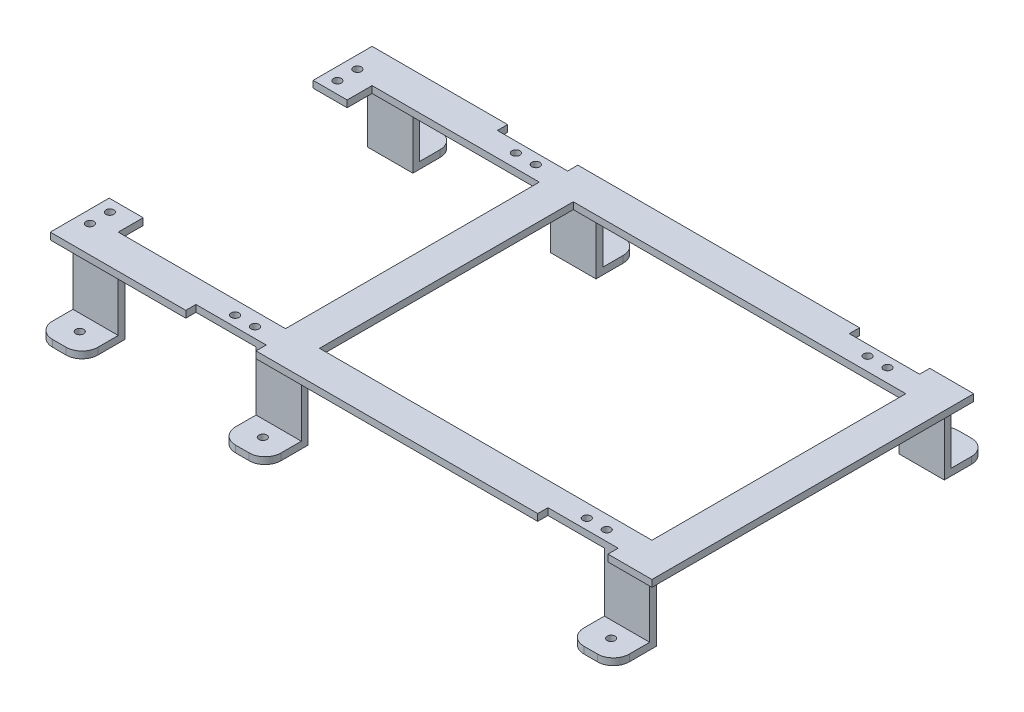
from build123d import *

# Parameters (mm, degrees)
CROQUIS1_W                 = 265.5
CROQUIS1_H                 = 142
CROQUIS1_W_2               = 235.5
CROQUIS1_H_2               = 112
SALIENTE_EXTRUIR1_DEPTH    = 3
SALIENTE_EXTRUIR2_DEPTH    = 20
SIMETR_A2_COPY_1_DEPTH     = 20
SALIENTE_EXTRUIR3_DEPTH    = 10
CROQUIS5_W                 = 38.206392887
CROQUIS5_H                 = 90
CORTAR_EXTRUIR2_DEPTH      = 160.539376017
CROQUIS6_W                 = 15
CROQUIS6_H                 = 112
SALIENTE_EXTRUIR4_DEPTH    = 3
CROQUIS8_W                 = 31
CROQUIS8_H                 = 4.5
CORTAR_EXTRUIR4_DEPTH      = 3
CROQUIS9_R                 = 1.75
CORTAR_EXTRUIR5_DEPTH      = 160.539376017
CROQUIS11_R                = 1.75
CORTAR_EXTRUIR7_DEPTH      = 4
CROQUIS12_R                = 1.75
CORTAR_EXTRUIR8_DEPTH      = 4
REDONDEO1_R                = 7
REDONDEO2_R                = 7
CROQUIS13_R                = 1.75
CORTAR_EXTRUIR9_DEPTH      = 159.964815289
CROQUIS15_R                = 1.75
CORTAR_EXTRUIR10_DEPTH     = 159.964815289
SIMETR_A12_COPY_1_SKETCH_R = 1.75
SIMETR_A12_COPY_1_DEPTH    = 159.964815289
REDONDEO3_R                = 7


with BuildPart() as part:
    # Croquis1 → Saliente-Extruir1 (new body)
    with BuildSketch(Plane(origin=(0, 0, 0), x_dir=(1, 0, 0), z_dir=(0, 1, 0))):
        Rectangle(CROQUIS1_W, CROQUIS1_H)
        Rectangle(CROQUIS1_W_2, CROQUIS1_H_2, mode=Mode.SUBTRACT)
    extrude(amount=SALIENTE_EXTRUIR1_DEPTH)

    # Croquis2 → Saliente-Extruir2 (add)
    with BuildSketch(Plane.ZY.offset(127.25)):
        Polygon((66.5, 0), (66.5, -26), (82.5, -26), (82.5, -29), (63.5, -29), (63.5, 0), align=None)
    saliente_extruir2 = extrude(amount=-SALIENTE_EXTRUIR2_DEPTH)

    # Simetría1: Saliente-Extruir2 across plane
    add(saliente_extruir2.mirror(Plane(origin=(0, 0, 0), x_dir=(0, 0, 1), z_dir=(1, 0, 0))))

    # Simetría2: Saliente-Extruir2 across plane
    add(saliente_extruir2.mirror(Plane.XY))

    # Simetría2 copy 1 sketch → Simetría2 copy 1 (add)
    with BuildSketch(Plane(origin=(127.25, 0, 0), x_dir=(0, 0, -1), z_dir=(1, 0, 0))):
        Polygon((66.5, 0), (66.5, -26), (82.5, -26), (82.5, -29), (63.5, -29), (63.5, 0), align=None)
    extrude(amount=-SIMETR_A2_COPY_1_DEPTH)

    # Croquis4 → Saliente-Extruir3 (add, symmetric)
    with BuildSketch(Plane(origin=(-36.45, 0, 0), x_dir=(0, 0, -1), z_dir=(1, 0, 0))):
        Polygon((-82.5, -29), (-63.5, -29), (-63.5, 0), (-66.5, 0), (-66.5, -26), (-82.5, -26), align=None)
    saliente_extruir3 = extrude(amount=SALIENTE_EXTRUIR3_DEPTH, both=True)

    # Simetría4: Saliente-Extruir3 across plane
    add(saliente_extruir3.mirror(Plane.XY))

    # Croquis5 → Cortar-Extruir2 (cut, through all)
    with BuildSketch(Plane(origin=(0, 3, 0), x_dir=(1, 0, 0), z_dir=(0, 1, 0))):
        with Locations((-124.602228384, 0)):
            Rectangle(CROQUIS5_W, CROQUIS5_H)
    extrude(amount=-CORTAR_EXTRUIR2_DEPTH, mode=Mode.SUBTRACT)

    # Croquis6 → Saliente-Extruir4 (add)
    with BuildSketch(Plane(origin=(0, 3, 0), x_dir=(1, 0, 0), z_dir=(0, 1, 0))):
        with Locations((-36.45, 0)):
            Rectangle(CROQUIS6_W, CROQUIS6_H)
    extrude(amount=-SALIENTE_EXTRUIR4_DEPTH)

    # Croquis8 → Cortar-Extruir4 (cut)
    with BuildSketch(Plane(origin=(0, 3, 0), x_dir=(1, 0, 0), z_dir=(0, 1, 0))):
        with Locations((97.85, 68.75)):
            Rectangle(CROQUIS8_W, CROQUIS8_H)
        with Locations((-57.45, 68.75)):
            Rectangle(CROQUIS8_W, CROQUIS8_H)
    cortar_extruir4 = extrude(amount=-CORTAR_EXTRUIR4_DEPTH, mode=Mode.SUBTRACT)

    # Croquis9 → Cortar-Extruir5 (cut, through all)
    with BuildSketch(Plane(origin=(0, 3, 0), x_dir=(1, 0, 0), z_dir=(0, 1, 0))):
        with Locations(Location((-127.25, 59, 0), (0, 0, 270))):
            Circle(CROQUIS9_R)
        with Locations(Location((-127.25, 50.2, 0), (0, 0, 270))):
            Circle(CROQUIS9_R)
    cortar_extruir5 = extrude(amount=-CORTAR_EXTRUIR5_DEPTH, mode=Mode.SUBTRACT)

    # Croquis11 → Cortar-Extruir7 (cut)
    with BuildSketch(Plane(origin=(0, 3, 0), x_dir=(1, 0, 0), z_dir=(0, 1, 0))):
        with Locations(Location((103.750895814, 61.952994616, 0), (0, 0, 270))):
            Circle(CROQUIS11_R)
        with Locations(Location((94.950895814, 61.952994616, 0), (0, 0, 270))):
            Circle(CROQUIS11_R)
    cortar_extruir7 = extrude(amount=-CORTAR_EXTRUIR7_DEPTH, mode=Mode.SUBTRACT)

    # Croquis12 → Cortar-Extruir8 (cut)
    with BuildSketch(Plane(origin=(0, 3, 0), x_dir=(1, 0, 0), z_dir=(0, 1, 0))):
        with Locations(Location((-51.449104186, 61.952994616, 0), (0, 0, 270))):
            Circle(CROQUIS12_R)
        with Locations(Location((-60.249104186, 61.952994616, 0), (0, 0, 270))):
            Circle(CROQUIS12_R)
    cortar_extruir8 = extrude(amount=-CORTAR_EXTRUIR8_DEPTH, mode=Mode.SUBTRACT)

    # Simetría5: Cortar-Extruir5, Cortar-Extruir7, Cortar-Extruir8 across plane
    add(cortar_extruir5.mirror(Plane.XY), mode=Mode.SUBTRACT)
    add(cortar_extruir7.mirror(Plane.XY), mode=Mode.SUBTRACT)
    add(cortar_extruir8.mirror(Plane.XY), mode=Mode.SUBTRACT)

    # Simetría6: Cortar-Extruir4 across plane
    add(cortar_extruir4.mirror(Plane.XY), mode=Mode.SUBTRACT)

    # Redondeo1
    redondeo1_edges = [part.edges().sort_by_distance(p)[0] for p in [
        (-107.25, -27.5, 82.5),
        (-127.25, -27.5, 82.5),
    ]]
    fillet(redondeo1_edges, radius=REDONDEO1_R)

    # Redondeo2
    redondeo2_edges = [part.edges().sort_by_distance(p)[0] for p in [
        (-46.45, -27.5, 82.5),
        (-26.45, -27.5, 82.5),
        (127.25, -27.5, 82.5),
        (107.25, -27.5, 82.5),
    ]]
    fillet(redondeo2_edges, radius=REDONDEO2_R)

    # Croquis13 → Cortar-Extruir9 (cut, through all)
    with BuildSketch(Plane(origin=(0, -26, 0), x_dir=(1, 0, 0), z_dir=(0, 1, 0))):
        with Locations(Location((-117.25, -73.5, 0), (0, 0, 270))):
            Circle(CROQUIS13_R)
    cortar_extruir9 = extrude(amount=-CORTAR_EXTRUIR9_DEPTH, mode=Mode.SUBTRACT)

    # Simetría7: Cortar-Extruir9 across plane
    add(cortar_extruir9.mirror(Plane(origin=(0, 0, 0), x_dir=(0, 0, 1), z_dir=(1, 0, 0))), mode=Mode.SUBTRACT)

    # Croquis15 → Cortar-Extruir10 (cut, through all)
    with BuildSketch(Plane(origin=(0, -26, 0), x_dir=(1, 0, 0), z_dir=(0, 1, 0))):
        with Locations(Location((-36.45, -73.5, 0), (0, 0, 270))):
            Circle(CROQUIS15_R)
    cortar_extruir10 = extrude(amount=-CORTAR_EXTRUIR10_DEPTH, mode=Mode.SUBTRACT)

    # Simetría12: Cortar-Extruir9, Cortar-Extruir10 across plane
    add(cortar_extruir9.mirror(Plane.XY), mode=Mode.SUBTRACT)
    add(cortar_extruir10.mirror(Plane.XY), mode=Mode.SUBTRACT)

    # Simetría12 copy 1 sketch → Simetría12 copy 1 (cut, through all)
    with BuildSketch(Plane(origin=(0, -26, 0), x_dir=(-1, 0, 0), z_dir=(0, 1, 0))):
        with Locations(Location((-117.25, -73.5, 0), (0, 0, 270))):
            Circle(SIMETR_A12_COPY_1_SKETCH_R)
    extrude(amount=-SIMETR_A12_COPY_1_DEPTH, mode=Mode.SUBTRACT)

    # Redondeo3
    redondeo3_edges = [part.edges().sort_by_distance(p)[0] for p in [
        (-26.45, -27.5, -82.5),
        (-46.45, -27.5, -82.5),
        (107.25, -27.5, -82.5),
        (127.25, -27.5, -82.5),
        (-127.25, -27.5, -82.5),
        (-107.25, -27.5, -82.5),
    ]]
    fillet(redondeo3_edges, radius=REDONDEO3_R)


solid = part.part
